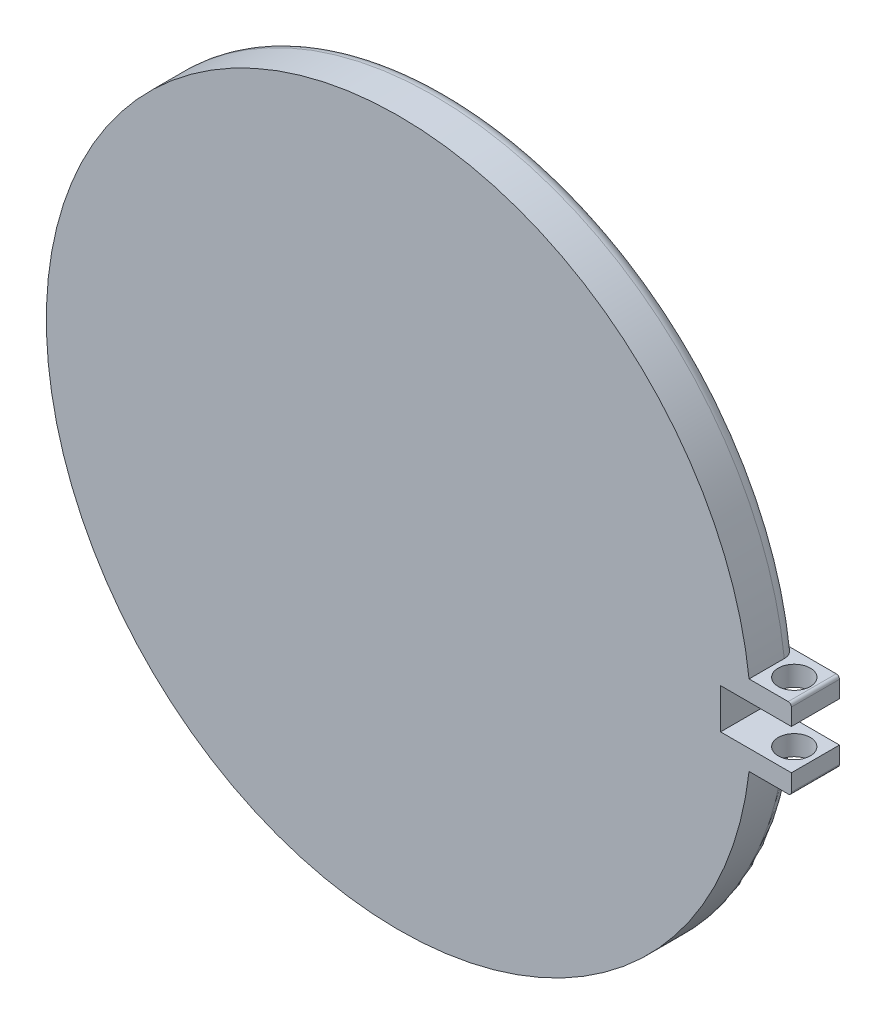
from build123d import *

# Parameters (mm, degrees)
SKETCH1_R               = 22
BOSS_EXTRUDE1_DEPTH     = 3
SKETCH2_W               = 5
SKETCH2_H               = 5
BOSS_EXTRUDE2_DEPTH     = 3
CUT_EXTRUDE1_DEPTH      = 35.777866525
CUT_EXTRUDE1_DEPTH_BACK = 35.777866525
SKETCH3_R               = 1
SKETCH4_W               = 3
SKETCH4_H               = 2.5
CUT_EXTRUDE2_DEPTH      = 2.6
FILLET1_R               = 0.2
FILLET2_R               = 0.8
SKETCH5_W               = 3
SKETCH5_H               = 2.5
CUT_EXTRUDE3_DEPTH      = 1.82


with BuildPart() as part:
    # Sketch1 → Boss-Extrude1 (new body)
    with BuildSketch(Plane.XY):
        Circle(SKETCH1_R)
    extrude(amount=BOSS_EXTRUDE1_DEPTH)

    # Sketch2 → Boss-Extrude2 (add)
    with BuildSketch(Plane.XY.offset(3)):
        with Locations((22, 0)):
            Rectangle(SKETCH2_W, SKETCH2_H)
    extrude(amount=-BOSS_EXTRUDE2_DEPTH)

    # Sketch3 → Cut-Extrude1 (cut, two sides: drawn at the far end of the back side and taken through both)
    with BuildSketch(Plane(origin=(0, 2.5, 0), x_dir=(1, 0, 0), z_dir=(0, 1, 0)).offset(-CUT_EXTRUDE1_DEPTH_BACK)):
        with Locations(Location((23.178746497, -1.5, 0), (0, 0, 270))):
            Circle(SKETCH3_R)
    extrude(amount=CUT_EXTRUDE1_DEPTH + CUT_EXTRUDE1_DEPTH_BACK, mode=Mode.SUBTRACT)

    # Sketch4 → Cut-Extrude2 (cut)
    with BuildSketch(Plane(origin=(24.5, 0, 0), x_dir=(0, 0, -1), z_dir=(1, 0, 0))):
        with Locations((-1.5, 0)):
            Rectangle(SKETCH4_W, SKETCH4_H)
    extrude(amount=-CUT_EXTRUDE2_DEPTH, mode=Mode.SUBTRACT)

    # Fillet1
    fillet1_edges = [part.edges().sort_by_distance(p)[0] for p in [
        (24.5, -2.5, 1.5),
        (24.5, 2.5, 1.5),
    ]]
    fillet(fillet1_edges, radius=FILLET1_R)

    # Fillet2
    fillet2_edges = [part.edges().sort_by_distance(p)[0] for p in [
        (-22, 0, 0),
    ]]
    fillet(fillet2_edges, radius=FILLET2_R)

    # Sketch5 → Cut-Extrude3 (cut)
    with BuildSketch(Plane(origin=(21.9, 0, 0), x_dir=(0, 0, -1), z_dir=(1, 0, 0))):
        with Locations((-1.5, 0)):
            Rectangle(SKETCH5_W, SKETCH5_H)
    extrude(amount=-CUT_EXTRUDE3_DEPTH, mode=Mode.SUBTRACT)


solid = part.part
